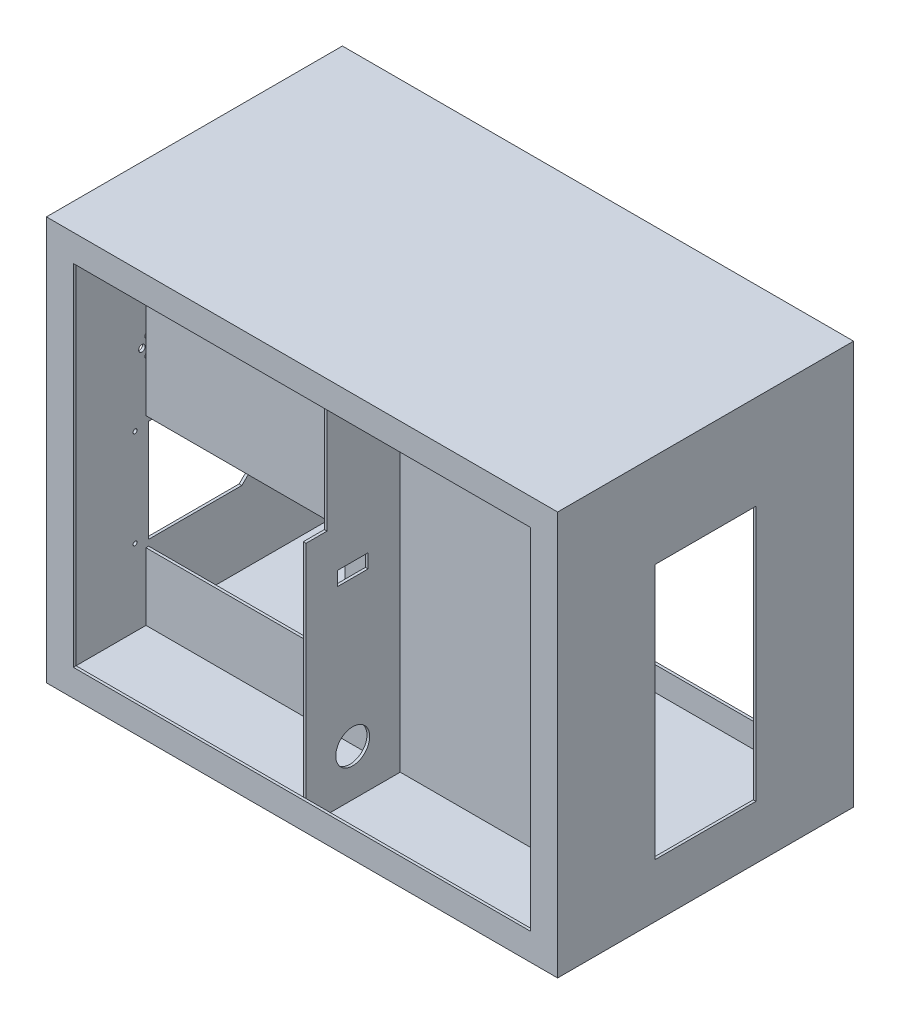
from build123d import *

# Parameters (mm, degrees)
CROQUIS1_W              = 380
CROQUIS1_H              = 300
SALIENTE_EXTRUIR1_DEPTH = 220
CROQUIS2_W              = 340
CROQUIS2_H              = 260
CORTAR_EXTRUIR1_DEPTH   = 328.108544676
CROQUIS3_W              = 75
CROQUIS3_H              = 190
CORTAR_EXTRUIR2_DEPTH   = 220
CROQUIS4_R              = 11.390943116
CROQUIS4_R_2            = 2.4
CROQUIS4_R_3            = 2.5
CROQUIS4_R_4            = 1.5
CROQUIS4_W              = 20.25056554
CROQUIS4_H              = 27.844527618
CORTAR_EXTRUIR3_DEPTH   = 10
CROQUIS5_W              = 376
CROQUIS5_H              = 296
CORTAR_EXTRUIR4_DEPTH   = 216
CROQUIS6_R              = 12.076613896
CROQUIS6_R_2            = 11.307687148
SALIENTE_EXTRUIR2_DEPTH = 2
CROQUIS7_R              = 12.59175444
CROQUIS7_W              = 22.934951081
CROQUIS7_H              = 10.424977764
SALIENTE_EXTRUIR3_DEPTH = 1


with BuildPart() as part:
    # Croquis1 → Saliente-Extruir1 (new body)
    with BuildSketch(Plane.XY):
        Rectangle(CROQUIS1_W, CROQUIS1_H)
    extrude(amount=SALIENTE_EXTRUIR1_DEPTH)

    # Croquis2 → Cortar-Extruir1 (cut, through all)
    with BuildSketch(Plane.XY.offset(220)):
        Rectangle(CROQUIS2_W, CROQUIS2_H)
    extrude(amount=-CORTAR_EXTRUIR1_DEPTH, mode=Mode.SUBTRACT)

    # Croquis3 → Cortar-Extruir2 (cut)
    with BuildSketch(Plane(origin=(190, 0, 0), x_dir=(0, 0, -1), z_dir=(1, 0, 0))):
        with Locations((-110, -15)):
            Rectangle(CROQUIS3_W, CROQUIS3_H)
    extrude(amount=-CORTAR_EXTRUIR2_DEPTH, mode=Mode.SUBTRACT)

    # Croquis4 → Cortar-Extruir3 (cut)
    with BuildSketch(Plane.ZY.offset(190)):
        with Locations((32.162199629, 10.251978606)):
            Circle(CROQUIS4_R)
        with Locations((89.397829106, 64.426138345)):
            Circle(CROQUIS4_R_2)
        with Locations((85.645052356, 57.926138345)):
            Circle(CROQUIS4_R_3)
        with Locations((81.908351726, 51.426138345)):
            Circle(CROQUIS4_R_2)
        with Locations((78.139498856, 44.926138345)):
            Circle(CROQUIS4_R_2)
        with Locations((74.386722107, 38.426138345)):
            Circle(CROQUIS4_R_2)
        with Locations((71.017661336, 31.926138345)):
            Circle(CROQUIS4_R_2)
        with Locations((97.397829106, 64.426138345)):
            Circle(CROQUIS4_R_2)
        with Locations((105.397829106, 64.426138345)):
            Circle(CROQUIS4_R_2)
        with Locations((113.397829106, 64.426138345)):
            Circle(CROQUIS4_R_2)
        with Locations((121.397829106, 64.426138345)):
            Circle(CROQUIS4_R_2)
        with Locations((129.397829106, 64.426138345)):
            Circle(CROQUIS4_R_2)
        with Locations((93.645052356, 57.926138345)):
            Circle(CROQUIS4_R_3)
        with Locations((101.645052356, 57.926138345)):
            Circle(CROQUIS4_R_3)
        with Locations((109.645052356, 57.926138345)):
            Circle(CROQUIS4_R_3)
        with Locations((117.645052356, 57.926138345)):
            Circle(CROQUIS4_R_3)
        with Locations((125.645052356, 57.926138345)):
            Circle(CROQUIS4_R_3)
        with Locations((133.645052356, 57.926138345)):
            Circle(CROQUIS4_R_3)
        with Locations((89.908351726, 51.426138345)):
            Circle(CROQUIS4_R_2)
        with Locations((97.908351726, 51.426138345)):
            Circle(CROQUIS4_R_2)
        with Locations((105.908351726, 51.426138345)):
            Circle(CROQUIS4_R_2)
        with Locations((113.908351726, 51.426138345)):
            Circle(CROQUIS4_R_2)
        with Locations((121.908351726, 51.426138345)):
            Circle(CROQUIS4_R_2)
        with Locations((129.908351726, 51.426138345)):
            Circle(CROQUIS4_R_2)
        with Locations((137.908351726, 51.426138345)):
            Circle(CROQUIS4_R_2)
        with Locations((86.139498856, 44.926138345)):
            Circle(CROQUIS4_R_2)
        with Locations((94.139498856, 44.926138345)):
            Circle(CROQUIS4_R_2)
        with Locations((102.139498856, 44.926138345)):
            Circle(CROQUIS4_R_2)
        with Locations((110.139498856, 44.926138345)):
            Circle(CROQUIS4_R_2)
        with Locations((118.139498856, 44.926138345)):
            Circle(CROQUIS4_R_2)
        with Locations((126.139498856, 44.926138345)):
            Circle(CROQUIS4_R_2)
        with Locations((134.139498856, 44.926138345)):
            Circle(CROQUIS4_R_2)
        with Locations((142.139498856, 44.926138345)):
            Circle(CROQUIS4_R_2)
        with Locations((82.386722107, 38.426138345)):
            Circle(CROQUIS4_R_2)
        with Locations((90.386722107, 38.426138345)):
            Circle(CROQUIS4_R_2)
        with Locations((98.386722107, 38.426138345)):
            Circle(CROQUIS4_R_2)
        with Locations((106.386722107, 38.426138345)):
            Circle(CROQUIS4_R_2)
        with Locations((114.386722107, 38.426138345)):
            Circle(CROQUIS4_R_2)
        with Locations((122.386722107, 38.426138345)):
            Circle(CROQUIS4_R_2)
        with Locations((130.386722107, 38.426138345)):
            Circle(CROQUIS4_R_2)
        with Locations((138.386722107, 38.426138345)):
            Circle(CROQUIS4_R_2)
        with Locations((146.386722107, 38.426138345)):
            Circle(CROQUIS4_R_2)
        with Locations((79.017661336, 31.926138345)):
            Circle(CROQUIS4_R_2)
        with Locations((87.017661336, 31.926138345)):
            Circle(CROQUIS4_R_2)
        with Locations((95.017661336, 31.926138345)):
            Circle(CROQUIS4_R_2)
        with Locations((103.017661336, 31.926138345)):
            Circle(CROQUIS4_R_2)
        with Locations((111.017661336, 31.926138345)):
            Circle(CROQUIS4_R_2)
        with Locations((119.017661336, 31.926138345)):
            Circle(CROQUIS4_R_2)
        with Locations((127.017661336, 31.926138345)):
            Circle(CROQUIS4_R_2)
        with Locations((135.017661336, 31.926138345)):
            Circle(CROQUIS4_R_2)
        with Locations((143.017661336, 31.926138345)):
            Circle(CROQUIS4_R_2)
        with Locations((151.017661336, 31.926138345)):
            Circle(CROQUIS4_R_2)
        with Locations(Location((146.386722107, 25.426138345, 0), (0, 0, 180))):
            Circle(CROQUIS4_R_2)
        with Locations(Location((138.386722107, 25.426138345, 0), (0, 0, 180))):
            Circle(CROQUIS4_R_2)
        with Locations(Location((130.386722107, 25.426138345, 0), (0, 0, 180))):
            Circle(CROQUIS4_R_2)
        with Locations(Location((122.386722107, 25.426138345, 0), (0, 0, 180))):
            Circle(CROQUIS4_R_2)
        with Locations(Location((114.386722107, 25.426138345, 0), (0, 0, 180))):
            Circle(CROQUIS4_R_2)
        with Locations(Location((106.386722107, 25.426138345, 0), (0, 0, 180))):
            Circle(CROQUIS4_R_2)
        with Locations(Location((98.386722107, 25.426138345, 0), (0, 0, 180))):
            Circle(CROQUIS4_R_2)
        with Locations(Location((90.386722107, 25.426138345, 0), (0, 0, 180))):
            Circle(CROQUIS4_R_2)
        with Locations(Location((82.386722107, 25.426138345, 0), (0, 0, 180))):
            Circle(CROQUIS4_R_2)
        with Locations(Location((142.139498856, 18.926138345, 0), (0, 0, 180))):
            Circle(CROQUIS4_R_2)
        with Locations(Location((134.139498856, 18.926138345, 0), (0, 0, 180))):
            Circle(CROQUIS4_R_2)
        with Locations(Location((126.139498856, 18.926138345, 0), (0, 0, 180))):
            Circle(CROQUIS4_R_2)
        with Locations(Location((118.139498856, 18.926138345, 0), (0, 0, 180))):
            Circle(CROQUIS4_R_2)
        with Locations(Location((110.139498856, 18.926138345, 0), (0, 0, 180))):
            Circle(CROQUIS4_R_2)
        with Locations(Location((102.139498856, 18.926138345, 0), (0, 0, 180))):
            Circle(CROQUIS4_R_2)
        with Locations(Location((94.139498856, 18.926138345, 0), (0, 0, 180))):
            Circle(CROQUIS4_R_2)
        with Locations(Location((86.139498856, 18.926138345, 0), (0, 0, 180))):
            Circle(CROQUIS4_R_2)
        with Locations(Location((137.908351726, 12.426138345, 0), (0, 0, 180))):
            Circle(CROQUIS4_R_2)
        with Locations(Location((129.908351726, 12.426138345, 0), (0, 0, 180))):
            Circle(CROQUIS4_R_2)
        with Locations(Location((121.908351726, 12.426138345, 0), (0, 0, 180))):
            Circle(CROQUIS4_R_2)
        with Locations(Location((113.908351726, 12.426138345, 0), (0, 0, 180))):
            Circle(CROQUIS4_R_2)
        with Locations(Location((105.908351726, 12.426138345, 0), (0, 0, 180))):
            Circle(CROQUIS4_R_2)
        with Locations(Location((97.908351726, 12.426138345, 0), (0, 0, 180))):
            Circle(CROQUIS4_R_2)
        with Locations(Location((89.908351726, 12.426138345, 0), (0, 0, 180))):
            Circle(CROQUIS4_R_2)
        with Locations(Location((133.645052356, 5.926138345, 0), (0, 0, 180))):
            Circle(CROQUIS4_R_3)
        with Locations(Location((125.645052356, 5.926138345, 0), (0, 0, 180))):
            Circle(CROQUIS4_R_3)
        with Locations(Location((117.645052356, 5.926138345, 0), (0, 0, 180))):
            Circle(CROQUIS4_R_3)
        with Locations(Location((109.645052356, 5.926138345, 0), (0, 0, 180))):
            Circle(CROQUIS4_R_3)
        with Locations(Location((101.645052356, 5.926138345, 0), (0, 0, 180))):
            Circle(CROQUIS4_R_3)
        with Locations(Location((93.645052356, 5.926138345, 0), (0, 0, 180))):
            Circle(CROQUIS4_R_3)
        with Locations(Location((129.397829106, -0.573861655, 0), (0, 0, 180))):
            Circle(CROQUIS4_R_2)
        with Locations(Location((121.397829106, -0.573861655, 0), (0, 0, 180))):
            Circle(CROQUIS4_R_2)
        with Locations(Location((113.397829106, -0.573861655, 0), (0, 0, 180))):
            Circle(CROQUIS4_R_2)
        with Locations(Location((105.397829106, -0.573861655, 0), (0, 0, 180))):
            Circle(CROQUIS4_R_2)
        with Locations(Location((97.397829106, -0.573861655, 0), (0, 0, 180))):
            Circle(CROQUIS4_R_2)
        with Locations(Location((74.386722107, 25.426138345, 0), (0, 0, 180))):
            Circle(CROQUIS4_R_2)
        with Locations(Location((78.139498856, 18.926138345, 0), (0, 0, 180))):
            Circle(CROQUIS4_R_2)
        with Locations(Location((81.908351726, 12.426138345, 0), (0, 0, 180))):
            Circle(CROQUIS4_R_2)
        with Locations(Location((85.645052356, 5.926138345, 0), (0, 0, 180))):
            Circle(CROQUIS4_R_3)
        with Locations(Location((89.397829106, -0.573861655, 0), (0, 0, 180))):
            Circle(CROQUIS4_R_2)
        with Locations((156.1, -91.157964775)):
            Circle(CROQUIS4_R_4)
        with Locations((20.1, -91.157964775)):
            Circle(CROQUIS4_R_4)
        with Locations((20.1, -19)):
            Circle(CROQUIS4_R_4)
        with Locations((156.1, -19)):
            Circle(CROQUIS4_R_4)
        Polygon((20.77094559, 67.10607462), (23.228708677, 61.218816831), (36.644744815, 61.218816831), (39.812330981, 67.10607462), align=None)
        with Locations((32.161888706, 113.593016075)):
            Rectangle(CROQUIS4_W, CROQUIS4_H)
        Polygon((16, -25.853532457), (16, -87.853532457), (71, -87.853532457), (76.696315026, -93.549847483), (146, -93.549847483), (146, -17.549847483), (79.303684974, -17.549847483), (71, -25.853532457), align=None)
    extrude(amount=-CORTAR_EXTRUIR3_DEPTH, mode=Mode.SUBTRACT)

    # Croquis5 → Cortar-Extruir4 (cut)
    with BuildSketch(Plane.XY.offset(2)):
        Rectangle(CROQUIS5_W, CROQUIS5_H)
    extrude(amount=CORTAR_EXTRUIR4_DEPTH, mode=Mode.SUBTRACT)

    # Croquis6 → Saliente-Extruir2 (add)
    with BuildSketch(Plane.XY.offset(146)):
        Polygon((-40, -98), (-188, -98), (-188, -148), (188, -148), (188, 148), (-188, 148), (-188, -13), (-40, -13), align=None)
        with Locations((-40, 89.440251512)):
            Circle(CROQUIS6_R, mode=Mode.SUBTRACT)
        with Locations((-40, 123.229898844)):
            Circle(CROQUIS6_R_2, mode=Mode.SUBTRACT)
    extrude(amount=SALIENTE_EXTRUIR2_DEPTH)

    # Croquis7 → Saliente-Extruir3 (add, symmetric)
    with BuildSketch(Plane.ZY):
        Polygon((202.434802839, 134.482213154), (218, 134.482213154), (218, 148), (148, 148), (148, -148), (218, -148), (218, 34.402426621), (202.434802839, 34.402426621), align=None)
        with Locations((183.322343606, -113.632257626)):
            Circle(CROQUIS7_R, mode=Mode.SUBTRACT)
        with Locations((183.322343606, 0)):
            Rectangle(CROQUIS7_W, CROQUIS7_H, mode=Mode.SUBTRACT)
    extrude(amount=SALIENTE_EXTRUIR3_DEPTH, both=True)


solid = part.part
